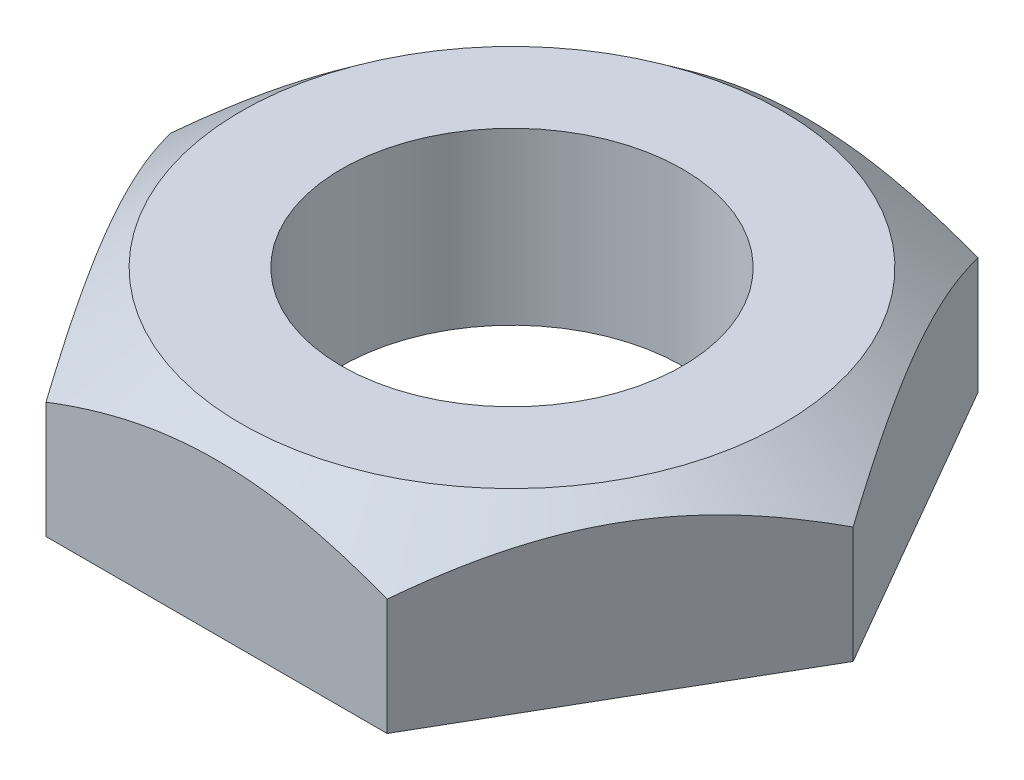
from build123d import *

# Parameters (mm, degrees)
SKETCH1_R           = 15
BOSS_EXTRUDE1_DEPTH = 15


with BuildPart() as part:
    # Sketch1 → Boss-Extrude1 (new body)
    with BuildSketch(Plane(origin=(0, 0, 0), x_dir=(1, 0, 0), z_dir=(0, 1, 0))):
        Polygon((30, 0), (15, 25.980762114), (-15, 25.980762114), (-30, 0), (-15, -25.980762114), (15, -25.980762114), align=None)
        with Locations(Location((0, 0, 0), (0, 0, 270))):
            Circle(SKETCH1_R, mode=Mode.SUBTRACT)
    extrude(amount=BOSS_EXTRUDE1_DEPTH)

    # Sketch3 → Cut-Revolve1 (revolve, cut)
    with BuildSketch(Plane.XY, mode=Mode.PRIVATE) as cut_revolve1_sk:
        Polygon((-30, 15), (-30, 10.235882569), (-23.813738417, 15), align=None)
    revolve(cut_revolve1_sk.sketch.rotate(Axis((0, 0, 0), (0, 1, 0)), 270), axis=Axis((0, 0, 0), (0, 1, 0)), mode=Mode.SUBTRACT)


solid = part.part
